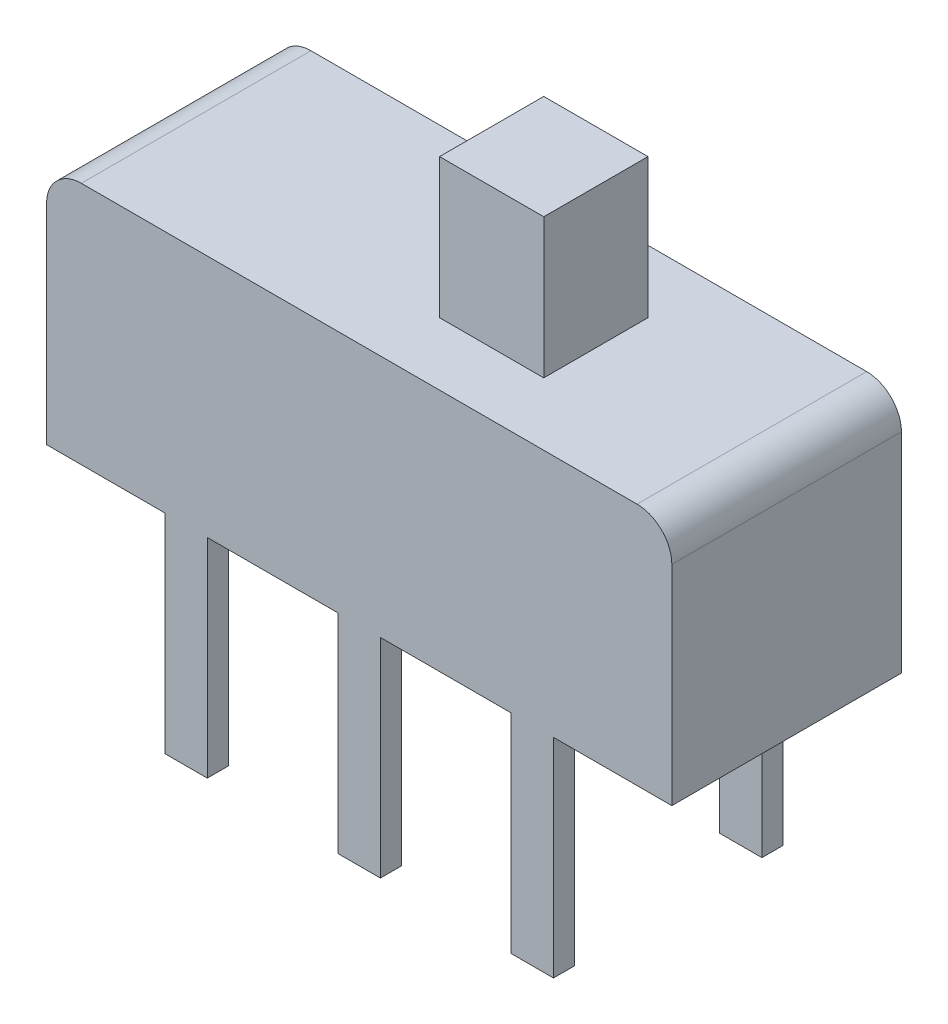
from build123d import *

# Parameters (mm, degrees)
SKETCH1_W               = 8.9916
SKETCH1_H               = 3.302
BOSS_EXTRUDE1_DEPTH     = 3.5052
SKETCH2_W               = 1.4986
SKETCH2_H               = 1.4986
BOSS_EXTRUDE2_DEPTH     = 2.0066
SKETCH3_W               = 0.6096
SKETCH3_H               = 0.3048
BOSS_EXTRUDE3_DEPTH     = 2.9972
LPATTERN1_COUNT         = 3
LPATTERN1_PITCH         = 2.4892
MIRROR1_COPY_1_SKETCH_W = 0.6096
MIRROR1_COPY_1_SKETCH_H = 0.3048
MIRROR1_COPY_1_DEPTH    = 2.9972
MIRROR1_COPY_2_SKETCH_W = 0.6096
MIRROR1_COPY_2_SKETCH_H = 0.3048
MIRROR1_COPY_2_DEPTH    = 2.9972
FILLET1_R               = 0.5


with BuildPart() as part:
    # Sketch1 → Boss-Extrude1 (new body)
    with BuildSketch(Plane(origin=(0, 0, 0), x_dir=(1, 0, 0), z_dir=(0, 1, 0))):
        Rectangle(SKETCH1_W, SKETCH1_H)
    extrude(amount=BOSS_EXTRUDE1_DEPTH)

    # Sketch2 → Boss-Extrude2 (add)
    with BuildSketch(Plane(origin=(0, 3.5052, 0), x_dir=(1, 0, 0), z_dir=(0, 1, 0))):
        with Locations((1.0033, 0)):
            Rectangle(SKETCH2_W, SKETCH2_H)
    extrude(amount=BOSS_EXTRUDE2_DEPTH)

    # Sketch3 → Boss-Extrude3 (add)
    with BuildSketch(Plane.XZ):
        with Locations((2.4892, 1.4986)):
            Rectangle(SKETCH3_W, SKETCH3_H)
    boss_extrude3 = extrude(amount=BOSS_EXTRUDE3_DEPTH)

    # LPattern1: Boss-Extrude3 ×3
    with Locations(*[(-i * LPATTERN1_PITCH, 0, 0) for i in range(1, LPATTERN1_COUNT)]):
        add(boss_extrude3)

    # Mirror1: Boss-Extrude3 across plane
    add(boss_extrude3.mirror(Plane.XY))

    # Mirror1 copy 1 sketch → Mirror1 copy 1 (add)
    with BuildSketch(Plane(origin=(-2.4892, 0, 0), x_dir=(1, 0, 0), z_dir=(0, -1, 0))):
        with Locations((2.4892, -1.4986)):
            Rectangle(MIRROR1_COPY_1_SKETCH_W, MIRROR1_COPY_1_SKETCH_H)
    extrude(amount=MIRROR1_COPY_1_DEPTH)

    # Mirror1 copy 2 sketch → Mirror1 copy 2 (add)
    with BuildSketch(Plane(origin=(-4.9784, 0, 0), x_dir=(1, 0, 0), z_dir=(0, -1, 0))):
        with Locations((2.4892, -1.4986)):
            Rectangle(MIRROR1_COPY_2_SKETCH_W, MIRROR1_COPY_2_SKETCH_H)
    extrude(amount=MIRROR1_COPY_2_DEPTH)

    # Fillet1
    fillet1_edges = [part.edges().sort_by_distance(p)[0] for p in [
        (4.4958, 3.5052, 0),
        (-4.4958, 3.5052, 0),
    ]]
    fillet(fillet1_edges, radius=FILLET1_R)


solid = part.part
